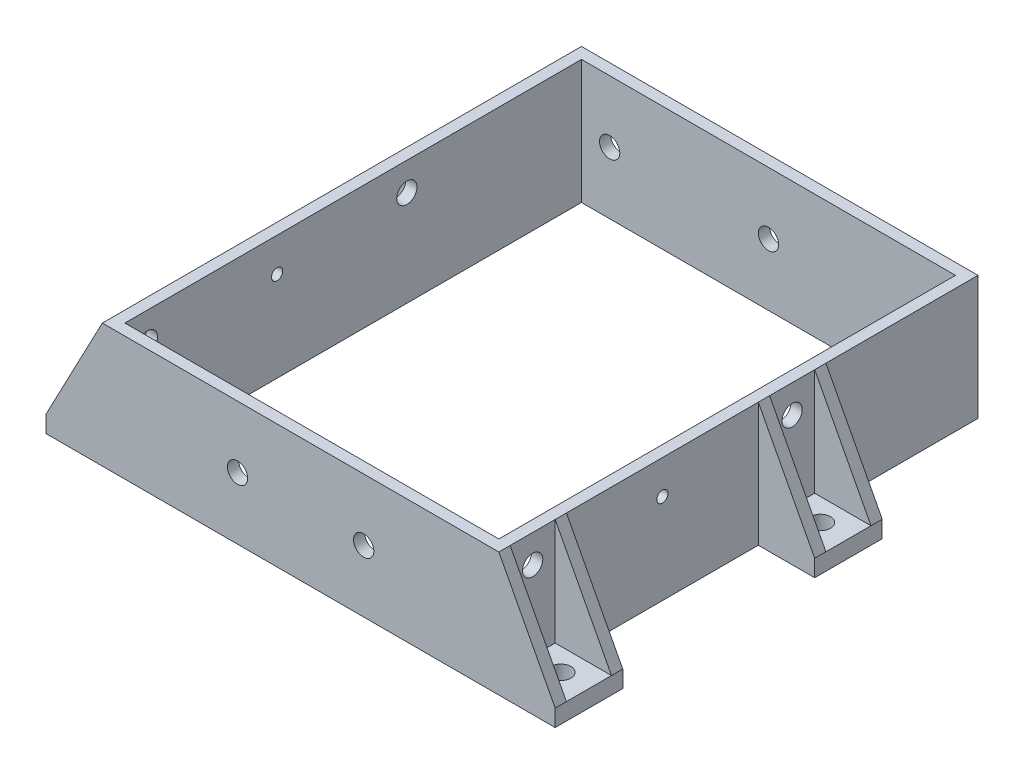
from build123d import *

# Parameters (mm, degrees)
SKETCH1_W                = 50
SKETCH1_H                = 9.1
BOSS_EXTRUDE1_DEPTH      = 2
SKETCH2_W                = 25
SKETCH2_H                = 6.6
CUT_EXTRUDE1_DEPTH       = 2
SKETCH3_R                = 1.8
CUT_EXTRUDE2_DEPTH       = 2
SKETCH4_W                = 66.4
SKETCH4_H                = 130
BOSS_EXTRUDE2_DEPTH      = 2
SKETCH5_W                = 66.4
SKETCH5_H                = 2
BOSS_EXTRUDE3_DEPTH      = 2.5
SKETCH6_W                = 8.6
SKETCH6_H                = 62.5
BOSS_EXTRUDE4_DEPTH      = 2
SKETCH7_R                = 1.8
SKETCH7_W                = 3
SKETCH7_H                = 5
CUT_EXTRUDE3_DEPTH       = 2
SKETCH8_W                = 25
SKETCH8_H                = 45
CUT_EXTRUDE4_DEPTH       = 20
SKETCH9_W                = 25
SKETCH9_H                = 10
BOSS_EXTRUDE5_DEPTH      = 2
SKETCH10_W               = 34.7
SKETCH10_H               = 27.07
BOSS_EXTRUDE6_DEPTH      = 2
SKETCH11_R               = 1.8
CUT_EXTRUDE5_DEPTH       = 2
SKETCH12_R               = 1.8
CUT_EXTRUDE6_DEPTH       = 2
SKETCH13_W               = 2
SKETCH13_H               = 2
BOSS_EXTRUDE7_DEPTH      = 44
SKETCH14_W               = 2
SKETCH14_H               = 2
BOSS_EXTRUDE8_DEPTH      = 46
SKETCH16_W               = 42
SKETCH16_H               = 43
BOSS_EXTRUDE10_DEPTH     = 2
SKETCH18_R               = 1.8
CUT_EXTRUDE7_DEPTH       = 2
BOSS_EXTRUDE12_DEPTH     = 2
SKETCH21_W               = 2
SKETCH21_H               = 2
BOSS_EXTRUDE13_DEPTH     = 10
SKETCH25_W               = 3
SKETCH25_H               = 5
CUT_EXTRUDE8_DEPTH       = 10
SKETCH26_W               = 6.2
SKETCH26_H               = 13
SKETCH26_W_2             = 21
SKETCH26_H_2             = 6.6
BOSS_EXTRUDE14_DEPTH     = 2
SKETCH27_W               = 2
SKETCH27_H               = 27
SKETCH27_H_2             = 24.93
BOSS_EXTRUDE15_DEPTH     = 2
SKETCH29_W               = 10
SKETCH29_H               = 10
BOSS_EXTRUDE19_DEPTH     = 2
SKETCH41_R               = 1.8
CUT_EXTRUDE15_DEPTH      = 2
BOSS_EXTRUDE26_DEPTH     = 2
SKETCH43_W               = 70.4
SKETCH43_H               = 2
BOSS_EXTRUDE27_DEPTH     = 11
SKETCH44_W               = 10
SKETCH44_H               = 5
BOSS_EXTRUDE28_DEPTH     = 2
SKETCH45_R               = 1.8
BOSS_EXTRUDE29_DEPTH     = 2
SKETCH46_R               = 1.8
CUT_EXTRUDE16_DEPTH      = 2
SKETCH47_W               = 10
SKETCH47_H               = 1
BOSS_EXTRUDE30_DEPTH     = 2
SKETCH48_W               = 32.7
SKETCH48_H               = 31.07
SKETCH48_W_2             = 101.75
SKETCH48_H_2             = 120.487369876
CUT_EXTRUDE17_DEPTH      = 20
SKETCH50_W               = 66.4
SKETCH50_H               = 81.07
CUT_EXTRUDE19_DEPTH      = 20
SKETCH51_W               = 70.4
SKETCH51_H               = 85.07
SKETCH51_W_2             = 66.4
SKETCH51_H_2             = 81.07
BOSS_EXTRUDE31_DEPTH     = 20
SKETCH52_W               = 10
SKETCH52_H               = 1
BOSS_EXTRUDE32_DEPTH     = 2
SKETCH53_W               = 10
SKETCH53_H               = 4
CUT_EXTRUDE20_DEPTH      = 2
BOSS_EXTRUDE33_START     = 1
SKETCH54_W               = 10
SKETCH54_H               = 12
SKETCH54_R               = 1.8
BOSS_EXTRUDE33_DEPTH     = 1
CUT_EXTRUDE23_DEPTH      = 96
CUT_EXTRUDE23_DEPTH_BACK = 16
SKETCH59_R               = 1.8
SKETCH62_W               = 66.985033768
SKETCH62_H               = 11.249394984
BOSS_EXTRUDE38_DEPTH     = 1
SKETCH65_R               = 1.8
CUT_EXTRUDE27_DEPTH      = 3
SKETCH66_R               = 1
CUT_EXTRUDE28_DEPTH      = 87
BOSS_EXTRUDE41_DEPTH     = 2
BOSS_EXTRUDE42_DEPTH     = 2
BOSS_EXTRUDE43_DEPTH     = 2
SKETCH68_W               = 6.791832398
SKETCH68_H               = 8.144168394
SKETCH68_W_2             = 5.485710784
SKETCH68_W_3             = 7.764004839
SKETCH68_H_2             = 11.628907231
BOSS_EXTRUDE44_DEPTH     = 2
BOSS_EXTRUDE45_DEPTH     = 2
SKETCH70_R               = 1.8
CUT_EXTRUDE29_DEPTH      = 83


with BuildPart() as part:
    # Sketch1 → Boss-Extrude1 (new body)
    with BuildSketch(Plane(origin=(0, 0, 0), x_dir=(1, 0, 0), z_dir=(0, 1, 0))):
        with Locations((25, 4.55)):
            Rectangle(SKETCH1_W, SKETCH1_H)
    extrude(amount=BOSS_EXTRUDE1_DEPTH)

    # Sketch2 → Cut-Extrude1 (cut)
    with BuildSketch(Plane(origin=(0, 2, 0), x_dir=(1, 0, 0), z_dir=(0, 1, 0))):
        with Locations((25, 5.8)):
            Rectangle(SKETCH2_W, SKETCH2_H)
    extrude(amount=-CUT_EXTRUDE1_DEPTH, mode=Mode.SUBTRACT)

    # Sketch3 → Cut-Extrude2 (cut)
    with BuildSketch(Plane(origin=(0, 2, 0), x_dir=(1, 0, 0), z_dir=(0, 1, 0))):
        with Locations(Location((6.25, 5.8, 0), (0, 0, 270))):
            Circle(SKETCH3_R)
        with Locations(Location((43.75, 5.8, 0), (0, 0, 270))):
            Circle(SKETCH3_R)
    extrude(amount=-CUT_EXTRUDE2_DEPTH, mode=Mode.SUBTRACT)

    # Sketch4 → Boss-Extrude2 (add)
    with BuildSketch(Plane(origin=(0, 2, 0), x_dir=(1, 0, 0), z_dir=(0, 1, 0))):
        with Locations((25, -65)):
            Rectangle(SKETCH4_W, SKETCH4_H)
    extrude(amount=-BOSS_EXTRUDE2_DEPTH)

    # Sketch5 → Boss-Extrude3 (add)
    with BuildSketch(Plane.XY.offset(130)):
        with Locations((25, 1)):
            Rectangle(SKETCH5_W, SKETCH5_H)
    extrude(amount=BOSS_EXTRUDE3_DEPTH)

    # Sketch6 → Boss-Extrude4 (add)
    with BuildSketch(Plane(origin=(0, 2, 0), x_dir=(1, 0, 0), z_dir=(0, 1, 0))):
        with Locations((-12.5, -101.25)):
            Rectangle(SKETCH6_W, SKETCH6_H)
        with Locations((62.5, -101.25)):
            Rectangle(SKETCH6_W, SKETCH6_H)
    extrude(amount=-BOSS_EXTRUDE4_DEPTH)

    # Sketch7 → Cut-Extrude3 (cut)
    with BuildSketch(Plane(origin=(0, 2, 0), x_dir=(1, 0, 0), z_dir=(0, 1, 0))):
        with Locations(Location((-13.5, -77, 0), (0, 0, 270))):
            Circle(SKETCH7_R)
        with Locations(Location((-13.5, -101.25, 0), (0, 0, 270))):
            Circle(SKETCH7_R)
        with Locations(Location((-13.5, -125.5, 0), (0, 0, 270))):
            Circle(SKETCH7_R)
        with Locations(Location((63.5, -77, 0), (0, 0, 270))):
            Circle(SKETCH7_R)
        with Locations(Location((63.5, -101.25, 0), (0, 0, 270))):
            Circle(SKETCH7_R)
        with Locations(Location((63.5, -125.5, 0), (0, 0, 270))):
            Circle(SKETCH7_R)
        with Locations((-13.5, -117.5)):
            Rectangle(SKETCH7_W, SKETCH7_H)
        with Locations((63.5, -117.5)):
            Rectangle(SKETCH7_W, SKETCH7_H)
    extrude(amount=-CUT_EXTRUDE3_DEPTH, mode=Mode.SUBTRACT)

    # Sketch8 → Cut-Extrude4 (cut)
    with BuildSketch(Plane(origin=(0, 2, 0), x_dir=(1, 0, 0), z_dir=(0, 1, 0))):
        with Locations((25, -22.5)):
            Rectangle(SKETCH8_W, SKETCH8_H)
    extrude(amount=-CUT_EXTRUDE4_DEPTH, mode=Mode.SUBTRACT)

    # Sketch9 → Boss-Extrude5 (add)
    with BuildSketch(Plane(origin=(0, 2, 0), x_dir=(1, 0, 0), z_dir=(0, 1, 0))):
        with Locations((25, -5)):
            Rectangle(SKETCH9_W, SKETCH9_H)
    extrude(amount=-BOSS_EXTRUDE5_DEPTH)

    # Sketch10 → Boss-Extrude6 (add)
    with BuildSketch(Plane(origin=(0, 2, 0), x_dir=(1, 0, 0), z_dir=(0, 1, 0))):
        with Locations((-25.55, -29.535)):
            Rectangle(SKETCH10_W, SKETCH10_H)
        with Locations((75.55, -29.535)):
            Rectangle(SKETCH10_W, SKETCH10_H)
    extrude(amount=-BOSS_EXTRUDE6_DEPTH)

    # Sketch11 → Cut-Extrude5 (cut)
    with BuildSketch(Plane(origin=(0, 2, 0), x_dir=(1, 0, 0), z_dir=(0, 1, 0))):
        with Locations(Location((-36.9, -19.25, 0), (0, 0, 270))):
            Circle(SKETCH11_R)
        with Locations(Location((-36.9, -39.82, 0), (0, 0, 270))):
            Circle(SKETCH11_R)
        with Locations(Location((-22.6, -19.25, 0), (0, 0, 270))):
            Circle(SKETCH11_R)
        with Locations(Location((-22.6, -39.82, 0), (0, 0, 270))):
            Circle(SKETCH11_R)
    extrude(amount=-CUT_EXTRUDE5_DEPTH, mode=Mode.SUBTRACT)

    # Sketch12 → Cut-Extrude6 (cut)
    with BuildSketch(Plane(origin=(0, 2, 0), x_dir=(1, 0, 0), z_dir=(0, 1, 0))):
        with Locations(Location((72.6, -19.25, 0), (0, 0, 270))):
            Circle(SKETCH12_R)
        with Locations(Location((86.9, -19.25, 0), (0, 0, 270))):
            Circle(SKETCH12_R)
        with Locations(Location((72.6, -39.82, 0), (0, 0, 270))):
            Circle(SKETCH12_R)
        with Locations(Location((86.9, -39.82, 0), (0, 0, 270))):
            Circle(SKETCH12_R)
    extrude(amount=-CUT_EXTRUDE6_DEPTH, mode=Mode.SUBTRACT)

    # Sketch13 → Boss-Extrude7 (add)
    with BuildSketch(Plane.ZY.offset(42.9)):
        with Locations((15, 1)):
            Rectangle(SKETCH13_W, SKETCH13_H)
        with Locations((44.07, 1)):
            Rectangle(SKETCH13_W, SKETCH13_H)
    extrude(amount=-BOSS_EXTRUDE7_DEPTH)

    # Sketch14 → Boss-Extrude8 (add)
    with BuildSketch(Plane(origin=(92.9, 0, 0), x_dir=(0, 0, -1), z_dir=(1, 0, 0))):
        with Locations((-15, 1)):
            Rectangle(SKETCH14_W, SKETCH14_H)
        with Locations((-44.07, 1)):
            Rectangle(SKETCH14_W, SKETCH14_H)
    extrude(amount=-BOSS_EXTRUDE8_DEPTH)

    # Sketch16 → Boss-Extrude10 (add)
    with BuildSketch(Plane(origin=(0, 2, 0), x_dir=(1, 0, 0), z_dir=(0, 1, 0))):
        with Locations((25, -154)):
            Rectangle(SKETCH16_W, SKETCH16_H)
    extrude(amount=-BOSS_EXTRUDE10_DEPTH)

    # Sketch18 → Cut-Extrude7 (cut)
    with BuildSketch(Plane(origin=(0, 2, 0), x_dir=(1, 0, 0), z_dir=(0, 1, 0))):
        with Locations(Location((8.74, -171.03, 0), (0, 0, 270))):
            Circle(SKETCH18_R)
        with Locations(Location((41.26, -171.03, 0), (0, 0, 270))):
            Circle(SKETCH18_R)
        with Locations(Location((8.74, -138.5, 0), (0, 0, 270))):
            Circle(SKETCH18_R)
        with Locations(Location((41.26, -138.5, 0), (0, 0, 270))):
            Circle(SKETCH18_R)
    extrude(amount=-CUT_EXTRUDE7_DEPTH, mode=Mode.SUBTRACT)

    # Sketch20 → Boss-Extrude12 (add)
    with BuildSketch(Plane(origin=(0, 2, 0), x_dir=(1, 0, 0), z_dir=(0, 1, 0))):
        with BuildLine():
            Line((-2, -132.5), (4, -132.5))
            Line((4, -132.5), (4, -138.5))
            ThreePointArc((4, -138.5), (2.242640687, -134.257359313), (-2, -132.5))
        make_face()
        with BuildLine():
            ThreePointArc((52, -132.5), (47.757359313, -134.257359313), (46, -138.5))
            Line((46, -138.5), (46, -132.5))
            Line((46, -132.5), (52, -132.5))
        make_face()
    extrude(amount=-BOSS_EXTRUDE12_DEPTH)

    # Sketch21 → Boss-Extrude13 (add)
    with BuildSketch(Plane(origin=(0, 0, -9.1), x_dir=(-1, 0, 0), z_dir=(0, 0, -1))):
        with Locations((-51, 1)):
            Rectangle(SKETCH21_W, SKETCH21_H)
        with Locations((-36.5, 1)):
            Rectangle(SKETCH21_W, SKETCH21_H)
        with Locations((-13.5, 1)):
            Rectangle(SKETCH21_W, SKETCH21_H)
        with Locations((1, 1)):
            Rectangle(SKETCH21_W, SKETCH21_H)
    extrude(amount=-BOSS_EXTRUDE13_DEPTH)

    # Sketch25 → Cut-Extrude8 (cut)
    with BuildSketch(Plane(origin=(0, 2, 0), x_dir=(1, 0, 0), z_dir=(0, 1, 0))):
        with Locations((-11.7, -22.5)):
            Rectangle(SKETCH25_W, SKETCH25_H)
        with Locations((-11.7, -36.57)):
            Rectangle(SKETCH25_W, SKETCH25_H)
        with Locations((61.7, -22.5)):
            Rectangle(SKETCH25_W, SKETCH25_H)
        with Locations((61.7, -36.57)):
            Rectangle(SKETCH25_W, SKETCH25_H)
    extrude(amount=-CUT_EXTRUDE8_DEPTH, mode=Mode.SUBTRACT)

    # Sketch26 → Boss-Extrude14 (add)
    with BuildSketch(Plane(origin=(0, 2, 0), x_dir=(1, 0, 0), z_dir=(0, 1, 0))):
        with Locations((-5.1, 6.5)):
            Rectangle(SKETCH26_W, SKETCH26_H)
        Polygon((-2, 13), (-2, 9.1), (14.5, 9.1), (35.5, 9.1), (52, 9.1), (52, 13), align=None)
        with Locations((25, 5.8)):
            Rectangle(SKETCH26_W_2, SKETCH26_H_2)
        with Locations((55.1, 6.5)):
            Rectangle(SKETCH26_W, SKETCH26_H)
    extrude(amount=-BOSS_EXTRUDE14_DEPTH)

    # Sketch27 → Boss-Extrude15 (add)
    with BuildSketch(Plane(origin=(0, 2, 0), x_dir=(1, 0, 0), z_dir=(0, 1, 0))):
        with Locations((-9.2, -0.5)):
            Rectangle(SKETCH27_W, SKETCH27_H)
        with Locations((-9.2, -57.535)):
            Rectangle(SKETCH27_W, SKETCH27_H_2)
        with Locations((59.2, -0.5)):
            Rectangle(SKETCH27_W, SKETCH27_H)
        with Locations((59.2, -57.535)):
            Rectangle(SKETCH27_W, SKETCH27_H_2)
    extrude(amount=-BOSS_EXTRUDE15_DEPTH)

    # Sketch29 → Boss-Extrude19 (add)
    with BuildSketch(Plane(origin=(0, 2, 0), x_dir=(1, 0, 0), z_dir=(0, 1, 0))):
        with Locations((-15.2, -9)):
            Rectangle(SKETCH29_W, SKETCH29_H)
        with Locations((-15.2, -50.07)):
            Rectangle(SKETCH29_W, SKETCH29_H)
        with Locations((65.2, -9)):
            Rectangle(SKETCH29_W, SKETCH29_H)
        with Locations((65.2, -50.07)):
            Rectangle(SKETCH29_W, SKETCH29_H)
    extrude(amount=-BOSS_EXTRUDE19_DEPTH)

    # Sketch41 → Cut-Extrude15 (cut)
    with BuildSketch(Plane(origin=(0, 2, 0), x_dir=(1, 0, 0), z_dir=(0, 1, 0))):
        with Locations(Location((-15.2, -9, 0), (0, 0, 270))):
            Circle(SKETCH41_R)
        with Locations(Location((-15.2, -50.07, 0), (0, 0, 270))):
            Circle(SKETCH41_R)
        with Locations(Location((65.2, -9, 0), (0, 0, 270))):
            Circle(SKETCH41_R)
        with Locations(Location((65.2, -50.07, 0), (0, 0, 270))):
            Circle(SKETCH41_R)
    extrude(amount=-CUT_EXTRUDE15_DEPTH, mode=Mode.SUBTRACT)

    # Sketch42 → Boss-Extrude26 (add)
    with BuildSketch(Plane(origin=(0, 2, 0), x_dir=(1, 0, 0), z_dir=(0, 1, 0))):
        with BuildLine():
            Line((-16.8, -70), (-10.2, -70))
            Line((-10.2, -70), (-10.2, -63.4))
            ThreePointArc((-10.2, -63.4), (-12.133095244, -68.066904756), (-16.8, -70))
        make_face()
        with BuildLine():
            Line((60.2, -63.4), (60.2, -70))
            Line((60.2, -70), (66.8, -70))
            ThreePointArc((66.8, -70), (62.133095244, -68.066904756), (60.2, -63.4))
        make_face()
    extrude(amount=-BOSS_EXTRUDE26_DEPTH)

    # Sketch43 → Boss-Extrude27 (add)
    with BuildSketch(Plane(origin=(0, 0, -13), x_dir=(-1, 0, 0), z_dir=(0, 0, -1))):
        with Locations((-25, 1)):
            Rectangle(SKETCH43_W, SKETCH43_H)
    extrude(amount=BOSS_EXTRUDE27_DEPTH)

    # Sketch44 → Boss-Extrude28 (add)
    with BuildSketch(Plane(origin=(0, 2, 0), x_dir=(1, 0, 0), z_dir=(0, 1, 0))):
        with Locations((-15.2, -57.57)):
            Rectangle(SKETCH44_W, SKETCH44_H)
        with Locations((65.2, -57.57)):
            Rectangle(SKETCH44_W, SKETCH44_H)
    extrude(amount=-BOSS_EXTRUDE28_DEPTH)

    # Sketch45 → Boss-Extrude29 (add)
    with BuildSketch(Plane(origin=(0, 2, 0), x_dir=(1, 0, 0), z_dir=(0, 1, 0))):
        with Locations((-15.2, -50.07)):
            Circle(SKETCH45_R)
        with Locations((65.2, -50.07)):
            Circle(SKETCH45_R)
    extrude(amount=-BOSS_EXTRUDE29_DEPTH)

    # Sketch46 → Cut-Extrude16 (cut)
    with BuildSketch(Plane(origin=(0, 2, 0), x_dir=(1, 0, 0), z_dir=(0, 1, 0))):
        with Locations(Location((-15.2, -55.07, 0), (0, 0, 270))):
            Circle(SKETCH46_R)
        with Locations(Location((65.2, -55.07, 0), (0, 0, 270))):
            Circle(SKETCH46_R)
    extrude(amount=-CUT_EXTRUDE16_DEPTH, mode=Mode.SUBTRACT)

    # Sketch47 → Boss-Extrude30 (add)
    with BuildSketch(Plane(origin=(0, 2, 0), x_dir=(1, 0, 0), z_dir=(0, 1, 0))):
        with Locations((-15.2, -3.5)):
            Rectangle(SKETCH47_W, SKETCH47_H)
        with Locations((-15.2, -60.57)):
            Rectangle(SKETCH47_W, SKETCH47_H)
        with Locations((65.2, -3.5)):
            Rectangle(SKETCH47_W, SKETCH47_H)
        with Locations((65.2, -60.57)):
            Rectangle(SKETCH47_W, SKETCH47_H)
    extrude(amount=-BOSS_EXTRUDE30_DEPTH)

    # Sketch48 → Cut-Extrude17 (cut)
    with BuildSketch(Plane(origin=(0, 2, 0), x_dir=(1, 0, 0), z_dir=(0, 1, 0))):
        with Locations((-26.55, -29.535)):
            Rectangle(SKETCH48_W, SKETCH48_H)
        with Locations((76.55, -29.535)):
            Rectangle(SKETCH48_W, SKETCH48_H)
        with Locations((30.675, -121.313684938)):
            Rectangle(SKETCH48_W_2, SKETCH48_H_2)
    extrude(amount=-CUT_EXTRUDE17_DEPTH, mode=Mode.SUBTRACT)

    # Sketch50 → Cut-Extrude19 (cut)
    with BuildSketch(Plane(origin=(0, 2, 0), x_dir=(1, 0, 0), z_dir=(0, 1, 0))):
        with Locations((25, -18.535)):
            Rectangle(SKETCH50_W, SKETCH50_H)
    extrude(amount=-CUT_EXTRUDE19_DEPTH, mode=Mode.SUBTRACT)

    # Sketch51 → Boss-Extrude31 (add)
    with BuildSketch(Plane(origin=(0, 2, 0), x_dir=(1, 0, 0), z_dir=(0, 1, 0))):
        with Locations((25, -18.535)):
            Rectangle(SKETCH51_W, SKETCH51_H)
        with Locations((25, -18.535)):
            Rectangle(SKETCH51_W_2, SKETCH51_H_2, mode=Mode.SUBTRACT)
    extrude(amount=BOSS_EXTRUDE31_DEPTH)

    # Sketch52 → Boss-Extrude32 (add)
    with BuildSketch(Plane(origin=(0, 2, 0), x_dir=(1, 0, 0), z_dir=(0, 1, 0))):
        with Locations((-15.2, -14.5)):
            Rectangle(SKETCH52_W, SKETCH52_H)
        with Locations((65.2, -14.5)):
            Rectangle(SKETCH52_W, SKETCH52_H)
    extrude(amount=-BOSS_EXTRUDE32_DEPTH)

    # Sketch53 → Cut-Extrude20 (cut)
    with BuildSketch(Plane(origin=(0, 2, 0), x_dir=(1, 0, 0), z_dir=(0, 1, 0))):
        with Locations((-15.2, -47.07)):
            Rectangle(SKETCH53_W, SKETCH53_H)
        with Locations((65.2, -47.07)):
            Rectangle(SKETCH53_W, SKETCH53_H)
    extrude(amount=-CUT_EXTRUDE20_DEPTH, mode=Mode.SUBTRACT)

    # Sketch54 → Boss-Extrude33 (add)
    # profile 1 of 4: a face of its own
    with BuildSketch(Plane(origin=(0, 2, 0), x_dir=(1, 0, 0), z_dir=(0, 1, 0)).offset(BOSS_EXTRUDE33_START)):
        with Locations((-15.2, -9)):
            Rectangle(SKETCH54_W, SKETCH54_H)
        with Locations(Location((-15.2, -9, 0), (0, 0, 270))):
            Circle(SKETCH54_R, mode=Mode.SUBTRACT)
    # profile 2 of 4: a face of its own
    with BuildSketch(Plane(origin=(0, 2, 0), x_dir=(1, 0, 0), z_dir=(0, 1, 0)).offset(BOSS_EXTRUDE33_START)):
        with Locations((-15.2, -55.07)):
            Rectangle(SKETCH54_W, SKETCH54_H)
        with Locations(Location((-15.2, -55.07, 0), (0, 0, 270))):
            Circle(SKETCH54_R, mode=Mode.SUBTRACT)
    # profile 3 of 4: a face of its own
    with BuildSketch(Plane(origin=(0, 2, 0), x_dir=(1, 0, 0), z_dir=(0, 1, 0)).offset(BOSS_EXTRUDE33_START)):
        with Locations((65.2, -9)):
            Rectangle(SKETCH54_W, SKETCH54_H)
        with Locations(Location((65.2, -9, 0), (0, 0, 270))):
            Circle(SKETCH54_R, mode=Mode.SUBTRACT)
    # profile 4 of 4: a face of its own
    with BuildSketch(Plane(origin=(0, 2, 0), x_dir=(1, 0, 0), z_dir=(0, 1, 0)).offset(BOSS_EXTRUDE33_START)):
        with Locations((65.2, -55.07)):
            Rectangle(SKETCH54_W, SKETCH54_H)
        with Locations(Location((65.2, -55.07, 0), (0, 0, 270))):
            Circle(SKETCH54_R, mode=Mode.SUBTRACT)
    extrude(amount=-BOSS_EXTRUDE33_DEPTH)

    # Sketch59 → Cut-Extrude23 (cut, two sides: drawn at the far end of the back side and taken through both)
    with BuildSketch(Plane.XY.offset(-22).offset(-CUT_EXTRUDE23_DEPTH_BACK)):
        with Locations((-3.2, 11)):
            Circle(SKETCH59_R)
        with Locations((53.2, 11)):
            Circle(SKETCH59_R)
        with Locations((25, 11)):
            Circle(SKETCH59_R)
    extrude(amount=CUT_EXTRUDE23_DEPTH + CUT_EXTRUDE23_DEPTH_BACK, mode=Mode.SUBTRACT)

    # Sketch62 → Boss-Extrude38 (add)
    with BuildSketch(Plane.XY.offset(61.07)):
        with Locations((24.914777311, 10.744331932)):
            Rectangle(SKETCH62_W, SKETCH62_H)
    extrude(amount=-BOSS_EXTRUDE38_DEPTH)

    # Sketch65 → Cut-Extrude27 (cut)
    with BuildSketch(Plane(origin=(0, 0, 59.07), x_dir=(-1, 0, 0), z_dir=(0, 0, -1))):
        with Locations((-13.8, 11)):
            Circle(SKETCH65_R)
        with Locations((-36.2, 11)):
            Circle(SKETCH65_R)
    extrude(amount=-CUT_EXTRUDE27_DEPTH, mode=Mode.SUBTRACT)

    # Sketch66 → Cut-Extrude28 (cut)
    with BuildSketch(Plane.ZY.offset(10.2)):
        with Locations((32.035, 16)):
            Circle(SKETCH66_R)
    extrude(amount=-CUT_EXTRUDE28_DEPTH, mode=Mode.SUBTRACT)

    # Sketch55 → Boss-Extrude41 (add)
    with BuildSketch(Plane(origin=(0, 0, 3), x_dir=(-1, 0, 0), z_dir=(0, 0, -1))):
        Polygon((20.2, 3), (10.2, 22), (10.2, 3), align=None)
        Polygon((-70.2, 3), (-60.2, 3), (-60.2, 22), align=None)
    extrude(amount=-BOSS_EXTRUDE41_DEPTH)

    # Sketch56 → Boss-Extrude42 (add)
    with BuildSketch(Plane.XY.offset(15)):
        Polygon((-20.2, 3), (-10.2, 3), (-10.2, 22), align=None)
        Polygon((70.2, 3), (60.2, 3), (60.2, 22), align=None)
    extrude(amount=-BOSS_EXTRUDE42_DEPTH)

    # Sketch57 → Boss-Extrude43 (add)
    with BuildSketch(Plane(origin=(0, 0, 49.07), x_dir=(-1, 0, 0), z_dir=(0, 0, -1))):
        Polygon((20.2, 3), (10.2, 3), (10.2, 22), align=None)
        Polygon((-70.2, 3), (-60.2, 3), (-60.2, 22), align=None)
    extrude(amount=-BOSS_EXTRUDE43_DEPTH)

    # Sketch68 → Boss-Extrude44 (add)
    with BuildSketch(Plane(origin=(0, 0, 59.07), x_dir=(-1, 0, 0), z_dir=(0, 0, -1))):
        with Locations((2.499419559, 10.346452983)):
            Rectangle(SKETCH68_W, SKETCH68_H)
        with Locations((-24.624372648, 10.346452983)):
            Rectangle(SKETCH68_W_2, SKETCH68_H)
        with Locations((-52.231743322, 12.088822401)):
            Rectangle(SKETCH68_W_3, SKETCH68_H_2)
    extrude(amount=-BOSS_EXTRUDE44_DEPTH)

    # Sketch69 → Boss-Extrude45 (add)
    with BuildSketch(Plane.XY.offset(61.07)):
        Polygon((-20.2, 3), (-10.2, 3), (-10.2, 22), align=None)
        Polygon((60.2, 3), (70.2, 3), (60.2, 22), align=None)
    extrude(amount=-BOSS_EXTRUDE45_DEPTH)

    # Sketch70 → Cut-Extrude29 (cut)
    with BuildSketch(Plane.ZY.offset(10.2)):
        with Locations((9, 17)):
            Circle(SKETCH70_R)
        with Locations((55.07, 17)):
            Circle(SKETCH70_R)
    extrude(amount=-CUT_EXTRUDE29_DEPTH, mode=Mode.SUBTRACT)


solid = part.part
